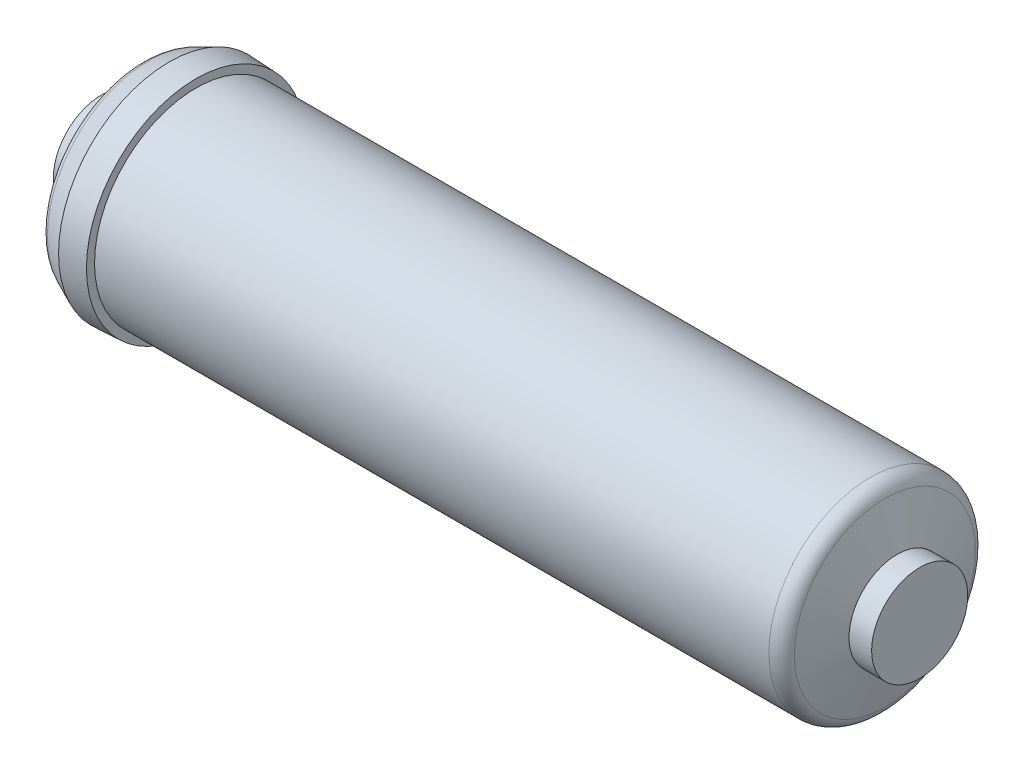
from build123d import *

# Parameters (mm, degrees)
FILLET1_R = 4.7625


with BuildPart() as part:
    # Sketch1 → Revolve1 (revolve)
    with BuildSketch(Plane.XY, mode=Mode.PRIVATE) as revolve1_sk:
        Polygon((257.175, 0), (257.175, 15.113), (250.063, 15.113), (245.237, 31.877), (29.718, 31.877), (29.718, 34.417), (21.336, 34.798), (12.954, 30.988), (7.9502, 15.113), (0, 15.113), (0, 0), align=None)
    revolve(revolve1_sk.sketch.rotate(Axis((0, 0, 0), (1, 0, 0)), 90), axis=Axis((0, 0, 0), (1, 0, 0)))

    # Fillet1
    fillet1_edges = [part.edges().sort_by_distance(p)[0] for p in [
        (12.954, 0, -30.988),
        (245.237, 0, -31.877),
    ]]
    fillet(fillet1_edges, radius=FILLET1_R)


solid = part.part
